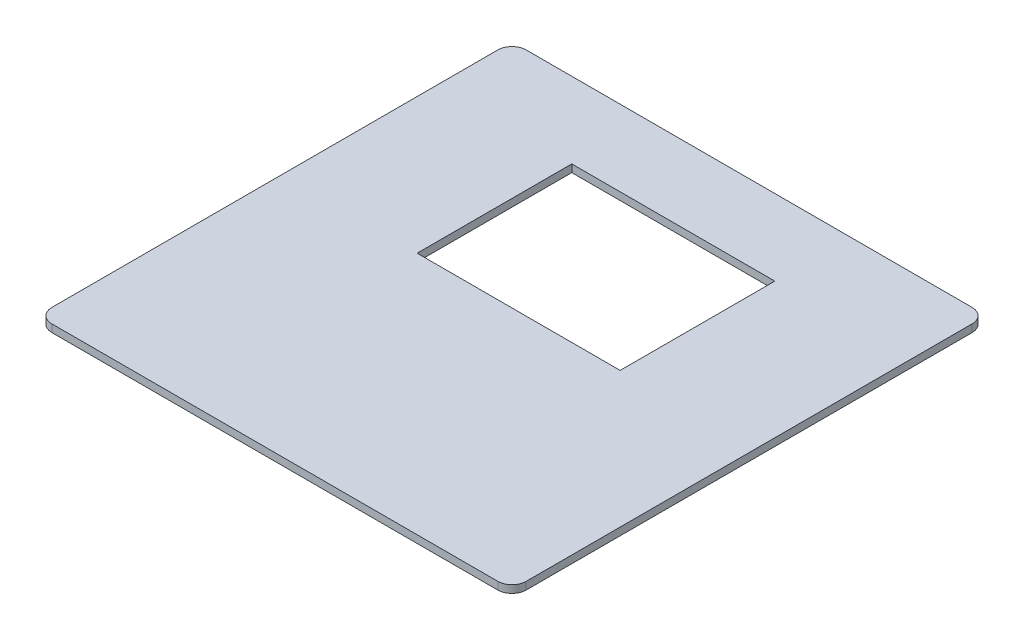
from build123d import *

# Parameters (mm, degrees)
SKETCH1_W           = 100
SKETCH1_H           = 100
SKETCH1_W_2         = 42.8
SKETCH1_H_2         = 32.6
BOSS_EXTRUDE1_DEPTH = 1.6
FILLET1_R           = 3


with BuildPart() as part:
    # Sketch1 → Boss-Extrude1 (new body)
    with BuildSketch(Plane(origin=(0, 2.62, 0), x_dir=(1, 0, 0), z_dir=(0, 1, 0))):
        with Locations((-66.833372467, -9.663854707)):
            Rectangle(SKETCH1_W, SKETCH1_H)
        with Locations((-66.833372467, 8.036145293)):
            Rectangle(SKETCH1_W_2, SKETCH1_H_2, mode=Mode.SUBTRACT)
    extrude(amount=BOSS_EXTRUDE1_DEPTH)

    # Fillet1
    fillet1_edges = [part.edges().sort_by_distance(p)[0] for p in [
        (-116.833372467, 3.42, -40.336145293),
        (-16.833372467, 3.42, -40.336145293),
        (-16.833372467, 3.42, 59.663854707),
        (-116.833372467, 3.42, 59.663854707),
    ]]
    fillet(fillet1_edges, radius=FILLET1_R)


solid = part.part
